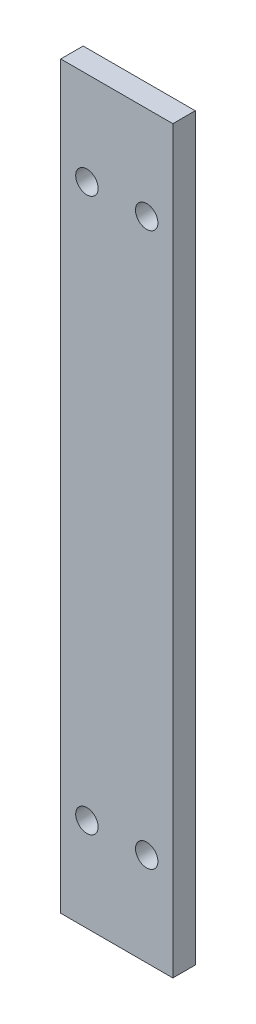
from build123d import *

# Parameters (mm, degrees)
SKETCH_1_W      = 15
SKETCH_1_H      = 99
SKETCH_1_R      = 1.5
EXTRUDE_1_DEPTH = 3


with BuildPart() as part:
    # 草图1 → 凸台-拉伸1 (new body)
    with BuildSketch(Plane.XY):
        Rectangle(SKETCH_1_W, SKETCH_1_H)
        with Locations((-4, 37)):
            Circle(SKETCH_1_R, mode=Mode.SUBTRACT)
        with Locations(Location((4, 37, 0), (0, 0, 180))):
            Circle(SKETCH_1_R, mode=Mode.SUBTRACT)
        with Locations((4, -37)):
            Circle(SKETCH_1_R, mode=Mode.SUBTRACT)
        with Locations(Location((-4, -37, 0), (0, 0, 180))):
            Circle(SKETCH_1_R, mode=Mode.SUBTRACT)
    extrude(amount=EXTRUDE_1_DEPTH)


solid = part.part
